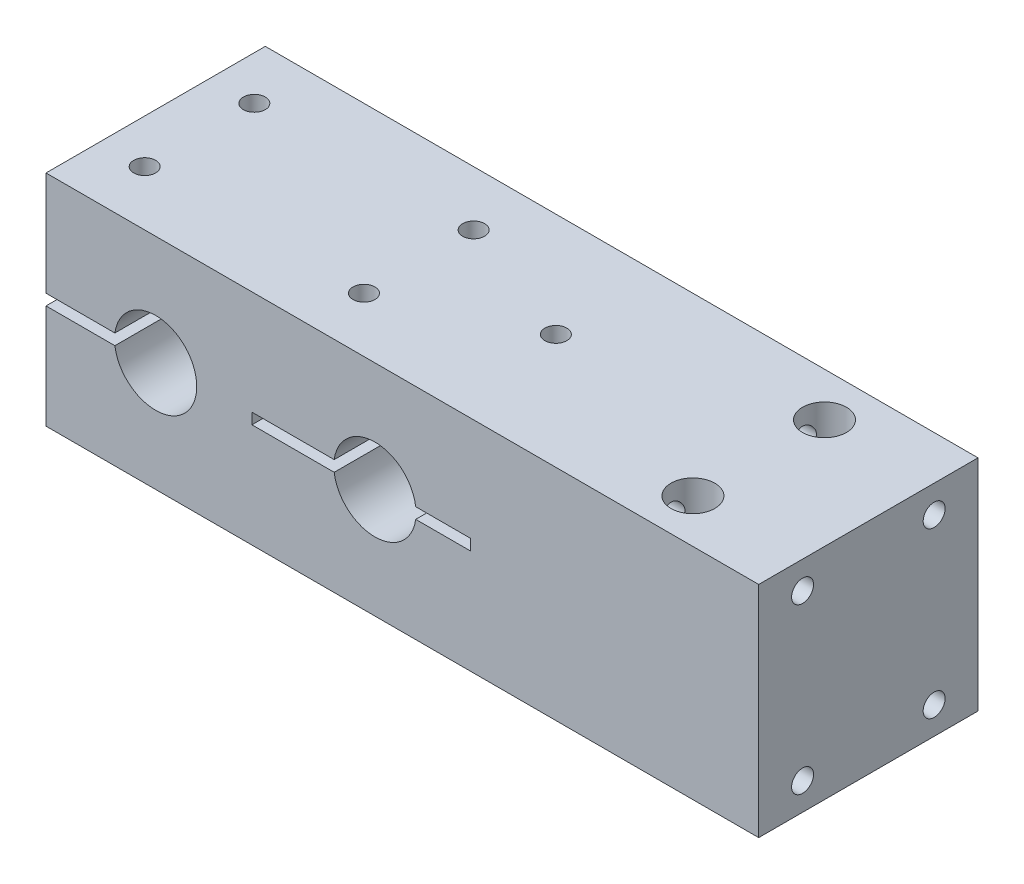
from build123d import *

# Parameters (mm, degrees)
EXTRUDE_1_DEPTH     = 40
SKETCH_8_R          = 2
CUT_EXTRUDE_1_DEPTH = 50
SKETCH_9_R          = 2
CUT_EXTRUDE_2_DEPTH = 30
SKETCH_10_R         = 4.000599978
SKETCH_10_R_2       = 4
CUT_EXTRUDE_3_DEPTH = 10
CUT_EXTRUDE_START   = -10
SKETCH_11_R         = 4
CUT_EXTRUDE_4_DEPTH = 10
SKETCH_12_R         = 2
CUT_EXTRUDE_5_DEPTH = 40


with BuildPart() as part:
    # Эскиз1 → Бобышка-Вытянуть1 (new body)
    with BuildSketch(Plane.XY):
        with BuildLine():
            Line((0, 0), (130, 0))
            Line((130, 0), (130, 40))
            Line((130, 40), (0, 40))
            Line((0, 40), (0, 21))
            Line((0, 21), (12.566965626, 21))
            ThreePointArc((12.566965626, 21), (27.5, 20), (12.566965626, 19))
            Line((12.566965626, 19), (0, 19))
            Line((0, 19), (0, 0))
        make_face()
        with BuildLine():
            Line((67.433034374, 21), (77.433034374, 21))
            Line((77.433034374, 21), (77.433034374, 19))
            Line((77.433034374, 19), (67.433034374, 19))
            ThreePointArc((67.433034374, 19), (60, 12.5), (52.566965626, 19))
            Line((52.566965626, 19), (37.566965626, 19))
            Line((37.566965626, 19), (37.566965626, 21))
            Line((37.566965626, 21), (52.566965626, 21))
            ThreePointArc((52.566965626, 21), (60, 27.5), (67.433034374, 21))
        make_face(mode=Mode.SUBTRACT)
    extrude(amount=EXTRUDE_1_DEPTH)

    # Эскиз8 → Вырез-Вытянуть1 (cut)
    with BuildSketch(Plane.XZ):
        with Locations(Location((8, 30, 0), (0, 0, 270))):
            Circle(SKETCH_8_R)
        with Locations(Location((8, 10, 0), (0, 0, 270))):
            Circle(SKETCH_8_R)
        with Locations(Location((48, 30, 0), (0, 0, 270))):
            Circle(SKETCH_8_R)
        with Locations(Location((48, 10, 0), (0, 0, 270))):
            Circle(SKETCH_8_R)
    extrude(amount=-CUT_EXTRUDE_1_DEPTH, mode=Mode.SUBTRACT)

    # Эскиз9 → Вырез-Вытянуть2 (cut)
    with BuildSketch(Plane(origin=(130, 0, 0), x_dir=(0, 0, -1), z_dir=(1, 0, 0))):
        with Locations((-32, 35)):
            Circle(SKETCH_9_R)
        with Locations((-8, 35)):
            Circle(SKETCH_9_R)
        with Locations((-8, 5)):
            Circle(SKETCH_9_R)
        with Locations((-32, 5)):
            Circle(SKETCH_9_R)
    extrude(amount=-CUT_EXTRUDE_2_DEPTH, mode=Mode.SUBTRACT)

    # Эскиз10 → Вырез-Вытянуть3 (cut)
    with BuildSketch(Plane(origin=(0, 40, 0), x_dir=(1, 0, 0), z_dir=(0, 1, 0))):
        with Locations(Location((110, -8, 0), (0, 0, 270))):
            Circle(SKETCH_10_R)
        with Locations(Location((110, -32, 0), (0, 0, 270))):
            Circle(SKETCH_10_R_2)
    extrude(amount=-CUT_EXTRUDE_3_DEPTH, mode=Mode.SUBTRACT)

    # Эскиз11 → Вырез-Вытянуть4 (cut)
    with BuildSketch(Plane.XZ.offset(CUT_EXTRUDE_START)):
        with Locations(Location((110, 32, 0), (0, 0, 90))):
            Circle(SKETCH_11_R)
        with Locations(Location((110, 8, 0), (0, 0, 270))):
            Circle(SKETCH_11_R)
    extrude(amount=CUT_EXTRUDE_4_DEPTH, mode=Mode.SUBTRACT)

    # Эскиз12 → Вырез-Вытянуть5 (cut)
    with BuildSketch(Plane.XZ):
        with Locations(Location((72, 19, 0), (0, 0, 270))):
            Circle(SKETCH_12_R)
    extrude(amount=-CUT_EXTRUDE_5_DEPTH, mode=Mode.SUBTRACT)


solid = part.part
